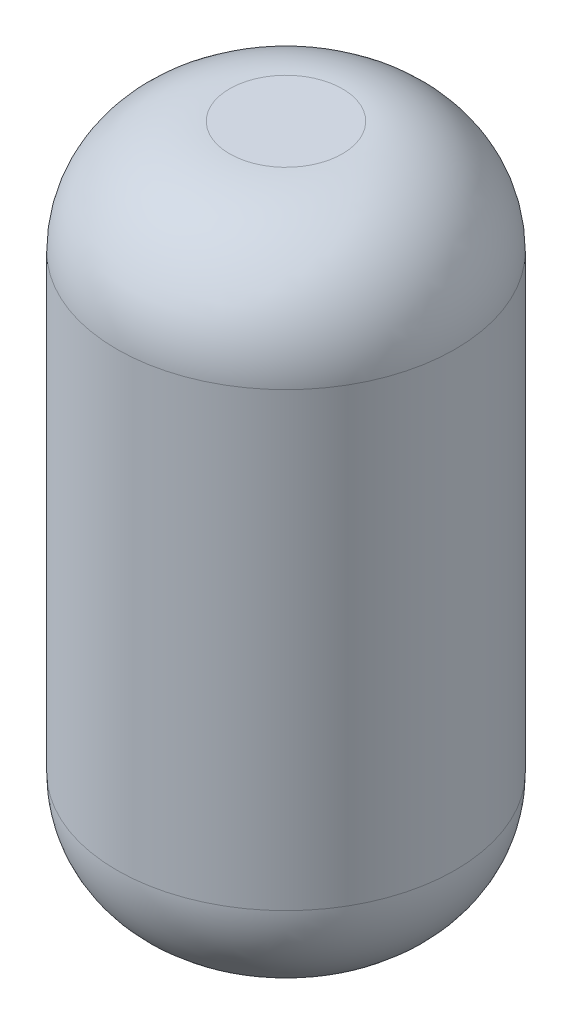
from build123d import *

# Parameters (mm, degrees)
SKETCH2_R          = 9.525
BASE_EXTRUDE_DEPTH = 38.1
FILLET1_R          = 6.35


with BuildPart() as part:
    # Sketch2 → Base-Extrude (new body)
    with BuildSketch(Plane(origin=(0, 0, 0), x_dir=(1, 0, 0), z_dir=(0, 1, 0))):
        with Locations(Location((0, 0, 0), (0, 0, 90))):
            Circle(SKETCH2_R)
    extrude(amount=BASE_EXTRUDE_DEPTH)

    # Fillet1
    fillet1_edges = [part.edges().sort_by_distance(p)[0] for p in [
        (0, 0, 9.525),
        (0, 38.1, 9.525),
    ]]
    fillet(fillet1_edges, radius=FILLET1_R)


solid = part.part
